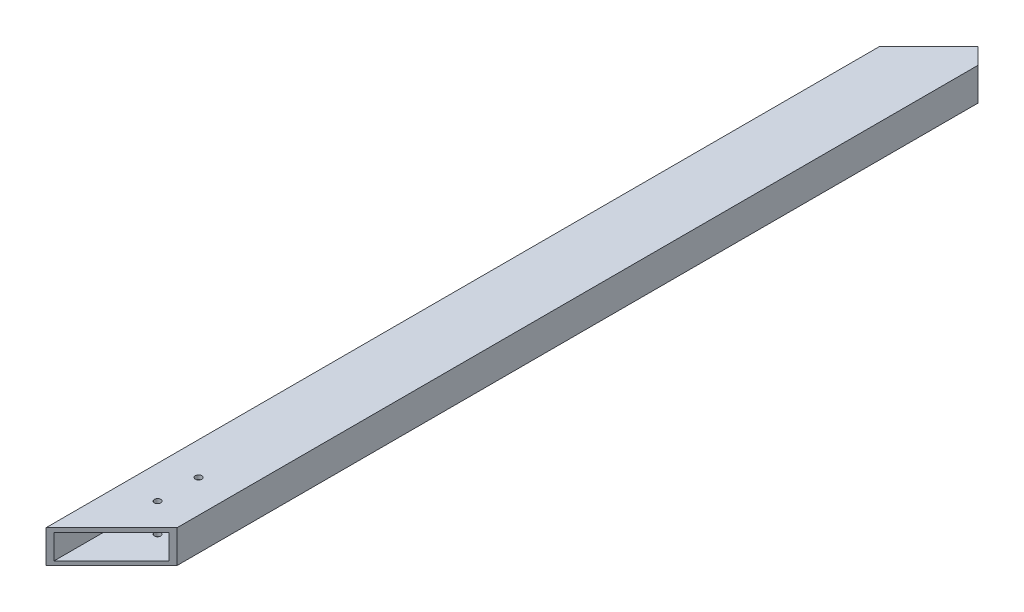
from build123d import *

# Parameters (mm, degrees)
SKETCH1_W                    = 50.8
SKETCH1_H                    = 25.4
SKETCH1_W_2                  = 44.45
SKETCH1_H_2                  = 19.05
BOSS_EXTRUDE1_DEPTH          = 697.2046
CUT_EXTRUDE1_DEPTH           = 699.129339207
CUT_EXTRUDE3_DEPTH           = 699.129339207
F_10_0_1935_DIAMETER_HOLE1_D = 4.9149


with BuildPart() as part:
    # Sketch1 → Boss-Extrude1 (new body)
    with BuildSketch(Plane.XY):
        Rectangle(SKETCH1_W, SKETCH1_H)
        Rectangle(SKETCH1_W_2, SKETCH1_H_2, mode=Mode.SUBTRACT)
    extrude(amount=BOSS_EXTRUDE1_DEPTH)

    # Sketch2 → Cut-Extrude1 (cut, through all)
    with BuildSketch(Plane(origin=(0, 12.7, 0), x_dir=(1, 0, 0), z_dir=(0, 1, 0))):
        Polygon((-25.4, -697.2046), (25.4, -646.4046), (25.4, -697.2046), align=None)
        Polygon((25.4, 0), (-25.4, -50.8), (-25.4, 0), align=None)
    extrude(amount=-CUT_EXTRUDE1_DEPTH, mode=Mode.SUBTRACT)

    # Sketch3 → Cut-Extrude3 (cut, through all)
    with BuildSketch(Plane(origin=(0, 12.7, 0), x_dir=(1, 0, 0), z_dir=(0, 1, 0))):
        Polygon((25.4, 0), (25.4, -25.2984), (12.7508, -12.6492), align=None)
    extrude(amount=-CUT_EXTRUDE3_DEPTH, mode=Mode.SUBTRACT)

    # #10 (0.1935) Diameter Hole1 (through all)
    with Locations(Plane(origin=(0, -12.7, 0), x_dir=(-1, 0, 0), z_dir=(0, -1, 0))):
        with Locations((0, -604.320502063), (0, -636.070502063)):
            Hole(F_10_0_1935_DIAMETER_HOLE1_D / 2)


solid = part.part
